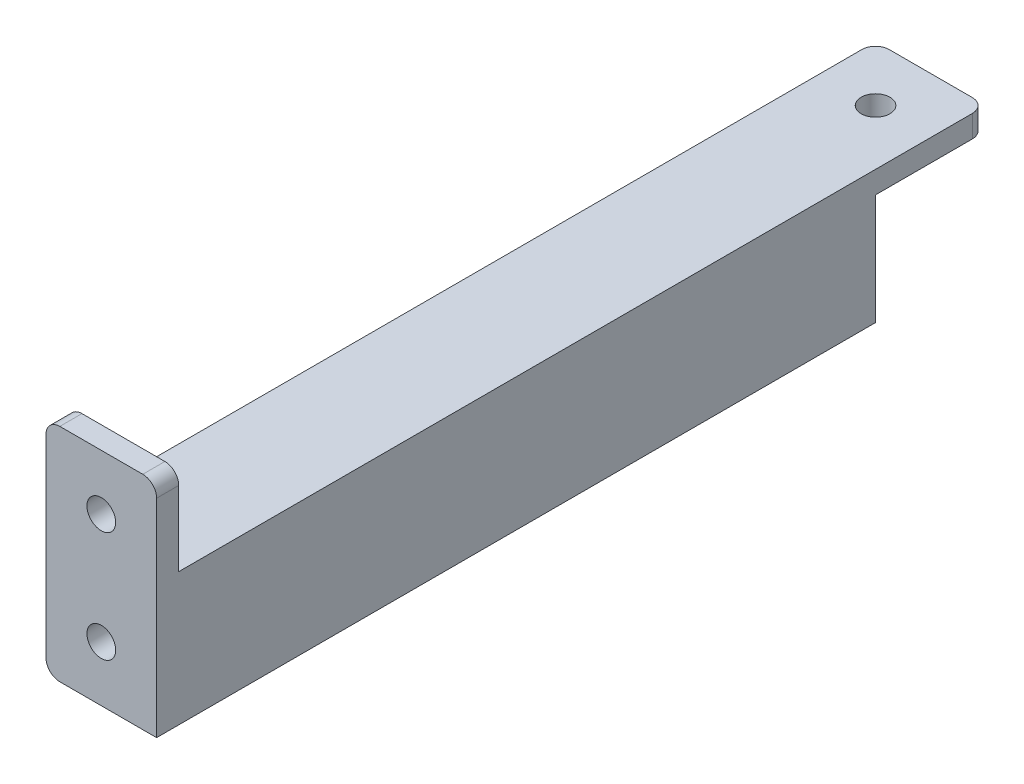
from build123d import *

# Parameters (mm, degrees)
SKETCH_1_W                  = 20
SKETCH_1_H                  = 20
EXTRUDE_1_DEPTH             = 4
EXTRUDE_2_DEPTH             = 130
EXTRUDE_2_DEPTH_BACK        = 20
SKETCH_2_W                  = 20
SKETCH_2_H                  = 4
SKETCH_3_W                  = 4
SKETCH_3_H                  = 24
EXTRUDE_3_DEPTH             = 130
SKETCH_4_W                  = 20
SKETCH_4_H                  = 40
EXTRUDE_4_DEPTH             = 4
HOLE_WIZARD_M53_D           = 5.2
HOLE_WIZARD_M53_ON_FACE_2_D = 5.2
HOLE_WIZARD_M53_ON_FACE_3_D = 5.2
FILLET_1_R                  = 2.5


with BuildPart() as part:
    # Эскиз1 → Бобышка-Вытянуть1 (new body)
    with BuildSketch(Plane.XY):
        with Locations((10, 10)):
            Rectangle(SKETCH_1_W, SKETCH_1_H)
    extrude(amount=EXTRUDE_1_DEPTH)

    # Эскиз2 → Бобышка-Вытянуть2 (add, two sides: drawn at the far end of the back side and taken through both)
    with BuildSketch(Plane.XY.offset(-EXTRUDE_2_DEPTH_BACK)):
        with Locations((10, 22)):
            Rectangle(SKETCH_2_W, SKETCH_2_H)
    extrude(amount=EXTRUDE_2_DEPTH + EXTRUDE_2_DEPTH_BACK)

    # Эскиз3 → Бобышка-Вытянуть3 (add)
    with BuildSketch(Plane(origin=(0, 0, 0), x_dir=(-1, 0, 0), z_dir=(0, 0, -1))):
        with Locations((-18, 12)):
            Rectangle(SKETCH_3_W, SKETCH_3_H)
    extrude(amount=-EXTRUDE_3_DEPTH)

    # Эскиз4 → Бобышка-Вытянуть4 (add)
    with BuildSketch(Plane.XY.offset(130)):
        with Locations((10, 20)):
            Rectangle(SKETCH_4_W, SKETCH_4_H)
    extrude(amount=-EXTRUDE_4_DEPTH)

    # Отверстие с зазором M53 (through all)
    with Locations(Plane(origin=(10, 10, 4), x_dir=(1, 0, 0), z_dir=(0, 0, 1))):
        with Locations((0, 0)):
            Hole(HOLE_WIZARD_M53_D / 2)

    # Отверстие с зазором M53 on face 2 (through all)
    with Locations(Plane(origin=(10, 24, -10), x_dir=(0, 0, 1), z_dir=(0, 1, 0))):
        with Locations((0, 0)):
            Hole(HOLE_WIZARD_M53_ON_FACE_2_D / 2)

    # Отверстие с зазором M53 on face 3 (through all)
    with Locations(Plane(origin=(10, 30, 126), x_dir=(-1, 0, 0), z_dir=(0, 0, -1))):
        with Locations((0, 0), (0, -20)):
            Hole(HOLE_WIZARD_M53_ON_FACE_3_D / 2)

    # Скругление1
    fillet_1_edges = [part.edges().sort_by_distance(p)[0] for p in [
        (0, 22, -20),
        (20, 22, -20),
        (0, 0, 128),
        (20, 40, 128),
        (0, 40, 128),
        (0, 0, 2),
    ]]
    fillet(fillet_1_edges, radius=FILLET_1_R)


solid = part.part
